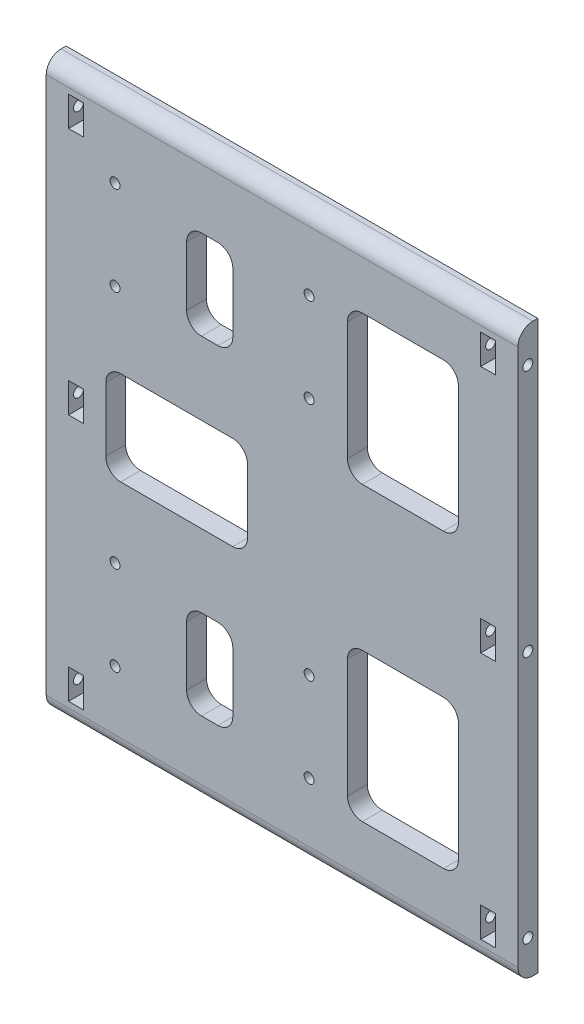
from build123d import *

# Parameters (mm, degrees)
ESQUISSE2_W             = 95.08
ESQUISSE2_H             = 114.3
ESQUISSE2_R             = 1
ESQUISSE2_W_2           = 22.362765252
ESQUISSE2_H_2           = 29.888087148
ESQUISSE2_W_3           = 9.312830524
ESQUISSE2_H_3           = 18
ESQUISSE2_W_4           = 28.571334831
ESQUISSE2_H_4           = 18.895330988
ESQUISSE2_W_5           = 3
ESQUISSE2_H_5           = 6
BOSS_EXTRU_1_DEPTH      = 4
CONG_1_R                = 3
ESQUISSE3_R             = 1
ENL_V_MAT_EXTRU_1_DEPTH = 10
ENL_V_START             = -10
ESQUISSE4_R             = 1
ENL_V_MAT_EXTRU_2_DEPTH = 10
CONG_2_R                = 3


with BuildPart() as part:
    # Esquisse2 → Boss.-Extru.1 (new body)
    with BuildSketch(Plane.XY):
        Rectangle(ESQUISSE2_W, ESQUISSE2_H)
        with Locations((-33.669054573, -42.15)):
            Circle(ESQUISSE2_R, mode=Mode.SUBTRACT)
        with Locations((5.450945427, -42.15)):
            Circle(ESQUISSE2_R, mode=Mode.SUBTRACT)
        with Locations((5.450945427, -24.15)):
            Circle(ESQUISSE2_R, mode=Mode.SUBTRACT)
        with Locations((-33.669054573, -24.15)):
            Circle(ESQUISSE2_R, mode=Mode.SUBTRACT)
        with Locations(Location((-33.669054573, 24.15, 0), (0, 0, 180))):
            Circle(ESQUISSE2_R, mode=Mode.SUBTRACT)
        with Locations(Location((5.450945427, 24.15, 0), (0, 0, 180))):
            Circle(ESQUISSE2_R, mode=Mode.SUBTRACT)
        with Locations(Location((5.450945427, 42.15, 0), (0, 0, 180))):
            Circle(ESQUISSE2_R, mode=Mode.SUBTRACT)
        with Locations(Location((-33.669054573, 42.15, 0), (0, 0, 180))):
            Circle(ESQUISSE2_R, mode=Mode.SUBTRACT)
        with Locations((24.358617374, 29.442657314)):
            Rectangle(ESQUISSE2_W_2, ESQUISSE2_H_2, mode=Mode.SUBTRACT)
        with Locations((-14.585732185, 33.15)):
            Rectangle(ESQUISSE2_W_3, ESQUISSE2_H_3, mode=Mode.SUBTRACT)
        with Locations((-14.585732185, -33.15)):
            Rectangle(ESQUISSE2_W_3, ESQUISSE2_H_3, mode=Mode.SUBTRACT)
        with Locations((-21.254332584, 0)):
            Rectangle(ESQUISSE2_W_4, ESQUISSE2_H_4, mode=Mode.SUBTRACT)
        with Locations((24.358617374, -29.442657314)):
            Rectangle(ESQUISSE2_W_2, ESQUISSE2_H_2, mode=Mode.SUBTRACT)
        with Locations((41.54, 0)):
            Rectangle(ESQUISSE2_W_5, ESQUISSE2_H_5, mode=Mode.SUBTRACT)
        with Locations((41.54, -50)):
            Rectangle(ESQUISSE2_W_5, ESQUISSE2_H_5, mode=Mode.SUBTRACT)
        with Locations((41.54, 50)):
            Rectangle(ESQUISSE2_W_5, ESQUISSE2_H_5, mode=Mode.SUBTRACT)
        with Locations((-41.54, 50)):
            Rectangle(ESQUISSE2_W_5, ESQUISSE2_H_5, mode=Mode.SUBTRACT)
        with Locations((-41.54, 0)):
            Rectangle(ESQUISSE2_W_5, ESQUISSE2_H_5, mode=Mode.SUBTRACT)
        with Locations((-41.54, -50)):
            Rectangle(ESQUISSE2_W_5, ESQUISSE2_H_5, mode=Mode.SUBTRACT)
    extrude(amount=BOSS_EXTRU_1_DEPTH)

    # Congé1
    cong_1_edges = [part.edges().sort_by_distance(p)[0] for p in [
        (-9.929316923, 24.15, 2),
        (-9.929316923, 42.15, 2),
        (-19.242147447, 42.15, 2),
        (-19.242147447, 24.15, 2),
        (-9.929316923, -42.15, 2),
        (-9.929316923, -24.15, 2),
        (-19.242147447, -24.15, 2),
        (-19.242147447, -42.15, 2),
        (-35.54, 9.447665494, 2),
        (-35.54, -9.447665494, 2),
        (-6.968665169, -9.447665494, 2),
        (-6.968665169, 9.447665494, 2),
        (35.54, -44.386700888, 2),
        (35.54, -14.49861374, 2),
        (13.177234748, -14.49861374, 2),
        (13.177234748, -44.386700888, 2),
        (35.54, 14.49861374, 2),
        (35.54, 44.386700888, 2),
        (13.177234748, 44.386700888, 2),
        (13.177234748, 14.49861374, 2),
    ]]
    fillet(cong_1_edges, radius=CONG_1_R)

    # Esquisse3 → Enlèv. mat.-Extru.1 (cut)
    with BuildSketch(Plane(origin=(47.54, 0, 0), x_dir=(0, 0, -1), z_dir=(1, 0, 0))):
        with Locations(Location((-2, 50, 0), (0, 0, 90))):
            Circle(ESQUISSE3_R)
        with Locations(Location((-2, 0, 0), (0, 0, 90))):
            Circle(ESQUISSE3_R)
        with Locations(Location((-2, -50, 0), (0, 0, 90))):
            Circle(ESQUISSE3_R)
    extrude(amount=-ENL_V_MAT_EXTRU_1_DEPTH, mode=Mode.SUBTRACT)

    # Esquisse4 → Enlèv. mat.-Extru.2 (cut)
    with BuildSketch(Plane.ZY.offset(47.54).offset(ENL_V_START)):
        with Locations(Location((2, 50, 0), (0, 0, 90))):
            Circle(ESQUISSE4_R)
        with Locations(Location((2, 0, 0), (0, 0, 90))):
            Circle(ESQUISSE4_R)
        with Locations(Location((2, -50, 0), (0, 0, 90))):
            Circle(ESQUISSE4_R)
    extrude(amount=ENL_V_MAT_EXTRU_2_DEPTH, mode=Mode.SUBTRACT)

    # Congé2
    cong_2_edges = [part.edges().sort_by_distance(p)[0] for p in [
        (0, -57.15, 4),
        (0, 57.15, 4),
    ]]
    fillet(cong_2_edges, radius=CONG_2_R)


solid = part.part
